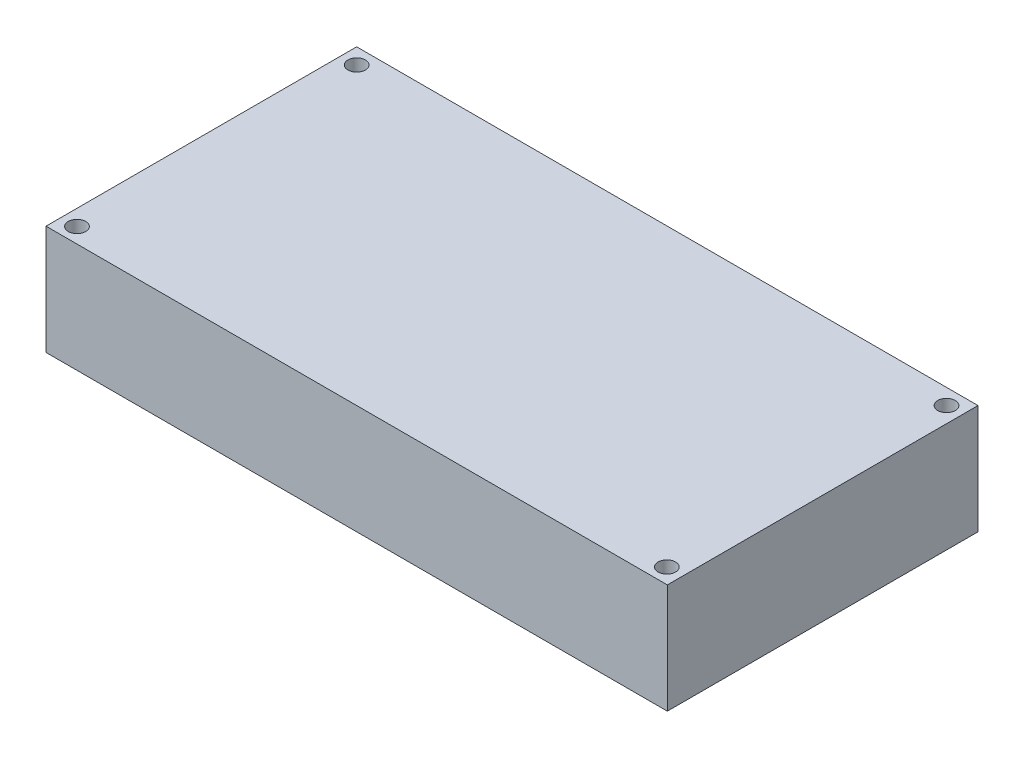
from build123d import *

# Parameters (mm, degrees)
SKETCH1_W           = 142
SKETCH1_H           = 71
BOSS_EXTRUDE1_DEPTH = 25
SKETCH2_R           = 2
CUT_EXTRUDE1_DEPTH  = 161.717142832


with BuildPart() as part:
    # Sketch1 → Boss-Extrude1 (new body)
    with BuildSketch(Plane(origin=(0, 0, 0), x_dir=(1, 0, 0), z_dir=(0, 1, 0))):
        with Locations((71, 35.5)):
            Rectangle(SKETCH1_W, SKETCH1_H)
    extrude(amount=BOSS_EXTRUDE1_DEPTH)

    # Sketch2 → Cut-Extrude1 (cut, through all)
    with BuildSketch(Plane(origin=(0, 25, 0), x_dir=(1, 0, 0), z_dir=(0, 1, 0))):
        with Locations(Location((3.6, 67.4, 0), (0, 0, 270))):
            Circle(SKETCH2_R)
        with Locations(Location((138.4, 67.4, 0), (0, 0, 90))):
            Circle(SKETCH2_R)
        with Locations(Location((138.4, 3.48, 0), (0, 0, 270))):
            Circle(SKETCH2_R)
        with Locations(Location((3.6, 3.48, 0), (0, 0, 90))):
            Circle(SKETCH2_R)
    extrude(amount=-CUT_EXTRUDE1_DEPTH, mode=Mode.SUBTRACT)


solid = part.part
